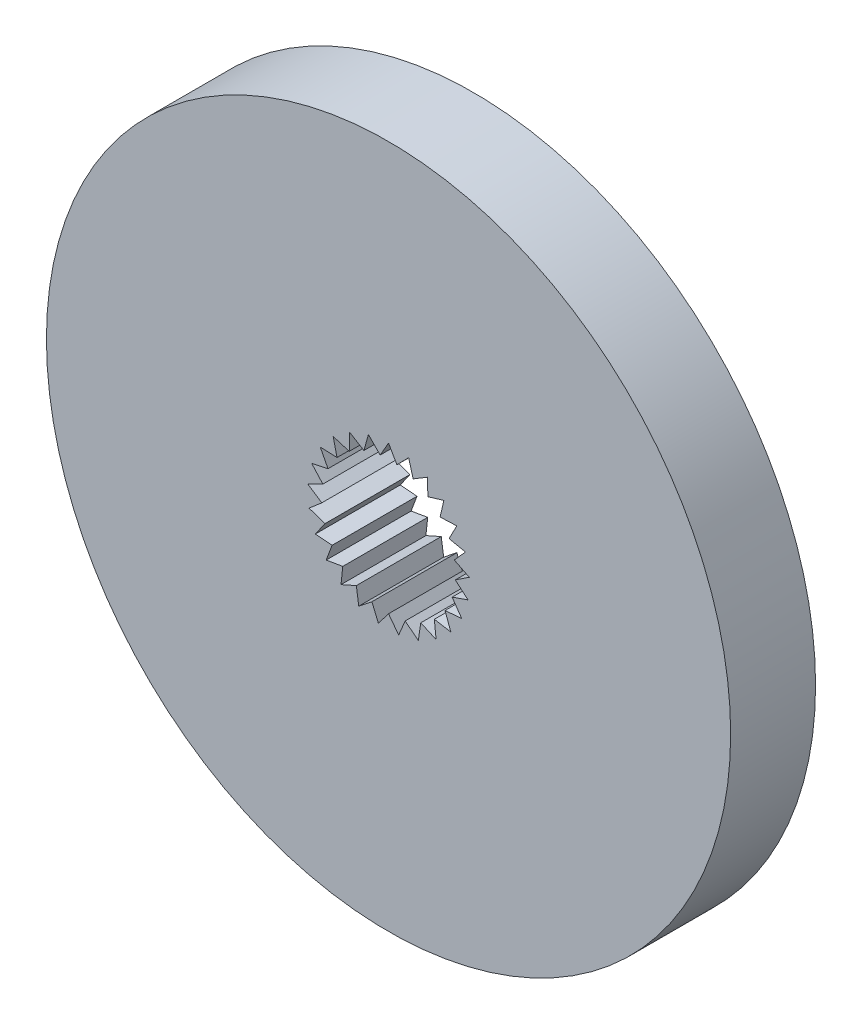
from build123d import *

# Parameters (mm, degrees)
SKETCH1_R           = 12.893401015
BOSS_EXTRUDE1_DEPTH = 3.2004


with BuildPart() as part:
    # Sketch1 → Boss-Extrude1 (new body)
    with BuildSketch(Plane.XY):
        Circle(SKETCH1_R)
        Polygon((0, 3.048), (-0.315924789, 2.500802214), (-0.758006776, 2.952241475), (-0.927923651, 2.343667613), (-1.468385199, 2.670982761), (-1.481617658, 2.039271757), (-2.086499579, 2.221896376), (-1.942216178, 1.606740957), (-2.573511517, 1.633200071), (-2.280778112, 1.073252713), (-2.898820262, 0.941883799), (-2.47603037, 0.472328054), (-3.041985468, 0.191385504), (-2.515704533, -0.158274714), (-2.99401154, -0.571138247), (-2.397307729, -0.778932499), (-2.757912856, -1.297775281), (-2.128279263, -1.350647091), (-2.348524364, -1.942868321), (-1.725523184, -1.837495558), (-1.791569449, -2.465883799), (-1.214346137, -2.208887422), (-1.122043637, -2.833958729), (-0.626867256, -2.441486766), (-0.382015696, -3.02396561), (0, -2.520678517), (0.382015696, -3.02396561), (0.626867256, -2.441486766), (1.122043637, -2.833958729), (1.214346137, -2.208887422), (1.791569449, -2.465883799), (1.725523184, -1.837495558), (2.348524364, -1.942868321), (2.128279263, -1.350647091), (2.757912856, -1.297775281), (2.397307729, -0.778932499), (2.99401154, -0.571138247), (2.515704533, -0.158274714), (3.041985468, 0.191385504), (2.47603037, 0.472328054), (2.898820262, 0.941883799), (2.280778112, 1.073252713), (2.573511517, 1.633200071), (1.942216178, 1.606740957), (2.086499579, 2.221896376), (1.481617658, 2.039271757), (1.468385199, 2.670982761), (0.927923651, 2.343667613), (0.758006776, 2.952241475), (0.315924789, 2.500802214), align=None, mode=Mode.SUBTRACT)
    extrude(amount=BOSS_EXTRUDE1_DEPTH)


solid = part.part
